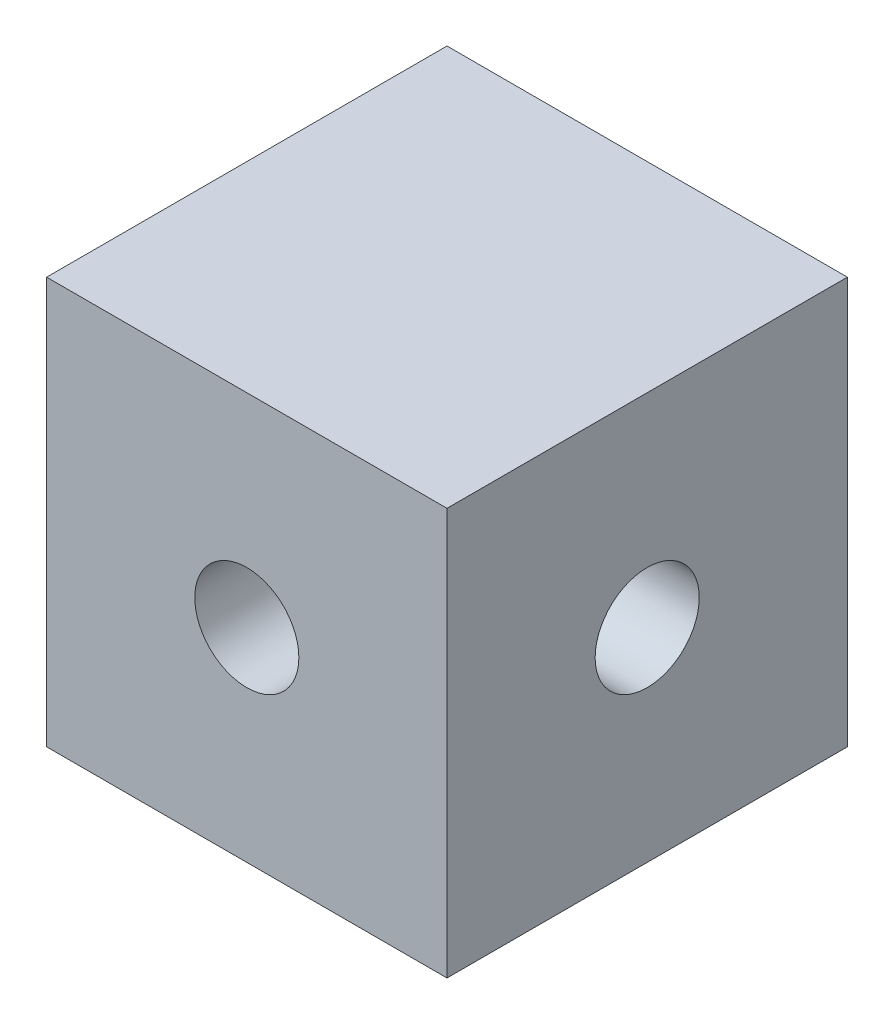
from build123d import *

# Parameters (mm, degrees)
BOSS_EXTRUDE1_DEPTH = 20.32
SKETCH3_R           = 2.6
CUT_EXTRUDE1_DEPTH  = 10.16
CIRPATTERN1_COUNT   = 4


with BuildPart() as part:
    # Sketch2 → Boss-Extrude1 (new body)
    with BuildSketch(Plane(origin=(0, 0, 0), x_dir=(1, 0, 0), z_dir=(0, 1, 0))):
        Polygon((-9.999999999999998, 10), (10.000000000000002, 10), (10.000000000000005, -10), (-9.999999999999995, -10), align=None)
    extrude(amount=BOSS_EXTRUDE1_DEPTH)

    # Sketch3 → Cut-Extrude1 (cut)
    with BuildSketch(Plane.XY.offset(10)):
        with Locations((8.7e-16, 10.16)):
            Circle(SKETCH3_R)
    cut_extrude1 = extrude(amount=-CUT_EXTRUDE1_DEPTH, mode=Mode.SUBTRACT)

    # CirPattern1: Cut-Extrude1 ×4 about axis
    cirpattern1_axis = Axis((1.73e-15, 20.32, 0), (-9e-17, -1, 0))
    for i in range(1, CIRPATTERN1_COUNT):
        add(cut_extrude1.rotate(cirpattern1_axis, i * 360 / CIRPATTERN1_COUNT), mode=Mode.SUBTRACT)


solid = part.part
